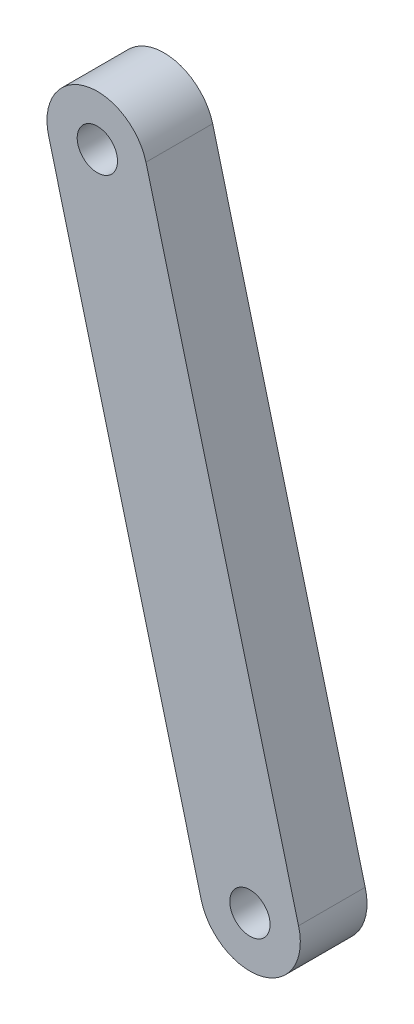
from build123d import *

# Parameters (mm, degrees)
SKETCH1_R           = 1
BOSS_EXTRUDE1_DEPTH = 3.31


with BuildPart() as part:
    # Sketch1 → Boss-Extrude1 (new body)
    with BuildSketch(Plane.XY):
        with BuildLine():
            ThreePointArc((-21.637138103, -115.972741453), (-24.707555295, -114.219875722), (-26.460421026, -117.290292914))
            Line((-26.460421026, -117.290292914), (-18.888051993, -146.318886184))
            ThreePointArc((-18.888051993, -146.318886184), (-15.817634801, -148.071751915), (-14.06476907, -145.001334723))
            Line((-14.06476907, -145.001334723), (-21.637138103, -115.972741453))
        make_face()
        with Locations((-16.476410532, -145.660110453)):
            Circle(SKETCH1_R, mode=Mode.SUBTRACT)
        with Locations((-24.048779565, -116.631517184)):
            Circle(SKETCH1_R, mode=Mode.SUBTRACT)
    extrude(amount=BOSS_EXTRUDE1_DEPTH)


solid = part.part
